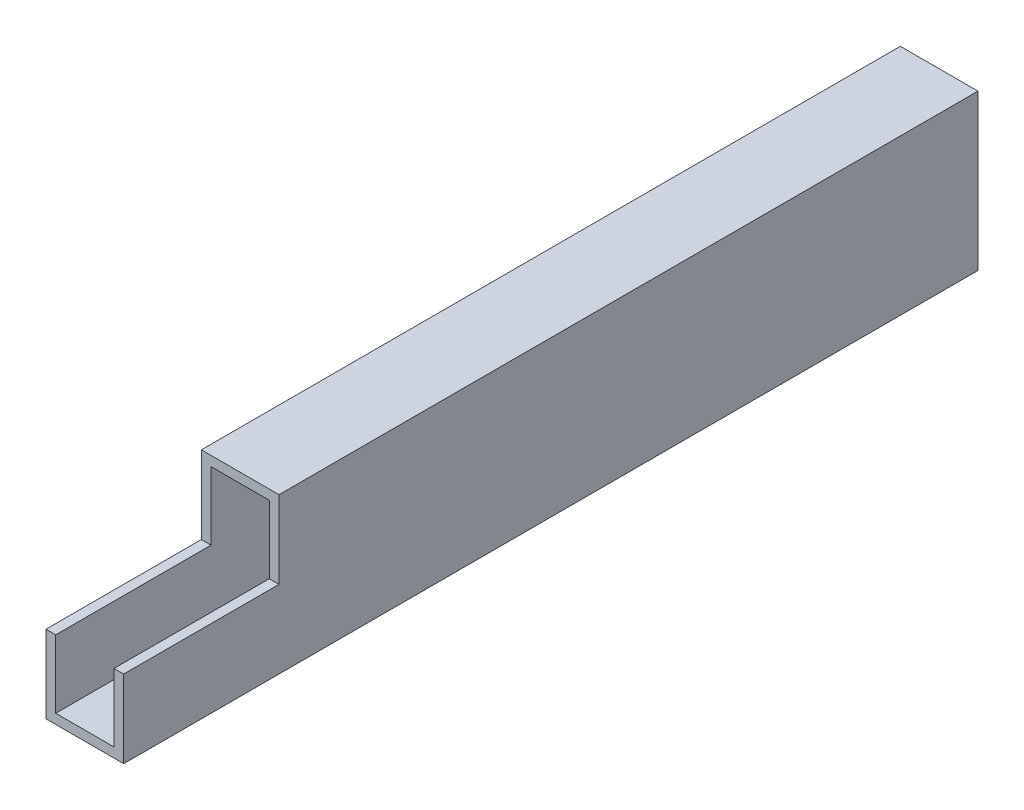
from build123d import *

# Parameters (mm, degrees)
SKETCH1_W           = 25.4
SKETCH1_H           = 50.8
SKETCH1_W_2         = 19.05
SKETCH1_H_2         = 44.45
BOSS_EXTRUDE1_DEPTH = 279.4
CUT_EXTRUDE1_REACH  = 287.114
SKETCH2_W           = 50.8
SKETCH2_H           = 25.4


with BuildPart() as part:
    # Sketch1 → Boss-Extrude1 (new body)
    with BuildSketch(Plane.XY):
        with Locations((12.7, -25.4)):
            Rectangle(SKETCH1_W, SKETCH1_H)
        with Locations((12.7, -25.4)):
            Rectangle(SKETCH1_W_2, SKETCH1_H_2, mode=Mode.SUBTRACT)
    extrude(amount=BOSS_EXTRUDE1_DEPTH)

    # Cut-Extrude1: up to this face of the body (flat: up to its plane)
    cut_extrude1_end = Plane(part.part.faces().sort_by_distance((0, -25.4, 139.7))[0])
    # Sketch2 → Cut-Extrude1 (cut, up to the picked face)
    with BuildSketch(Plane(origin=(25.4, 0, 0), x_dir=(0, 0, -1), z_dir=(1, 0, 0)), mode=Mode.PRIVATE) as cut_extrude1_sk1:
        with Locations((-254, -12.7)):
            Rectangle(SKETCH2_W, SKETCH2_H)
    cut_extrude1_tool1 = split(extrude(cut_extrude1_sk1.sketch, amount=-CUT_EXTRUDE1_REACH, mode=Mode.PRIVATE), bisect_by=cut_extrude1_end, keep=Keep.BOTH, mode=Mode.PRIVATE)
    add(cut_extrude1_tool1.solids().sort_by(Axis((25.4, -12.7, 254), (-1, 0, 0)))[0], mode=Mode.SUBTRACT)


solid = part.part
